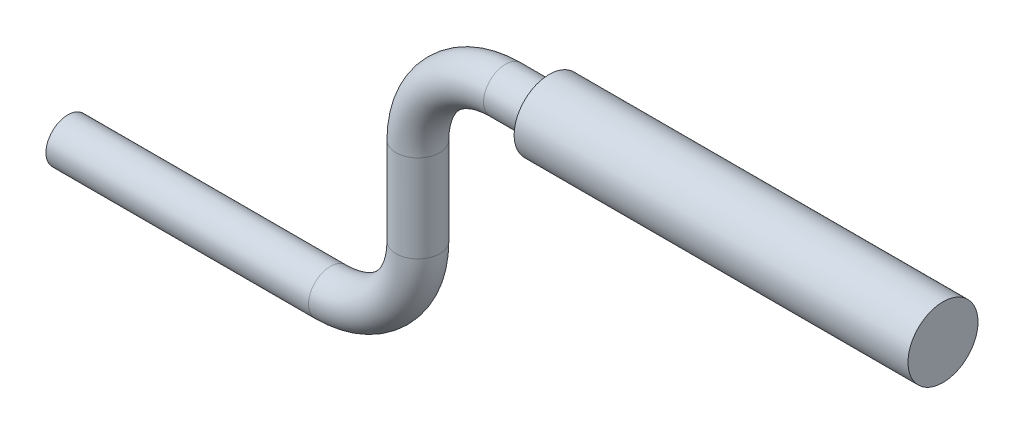
from build123d import *

# Parameters (mm, degrees)
ESQUISSE2_R        = 2.5
ESQUISSE3_R        = 4
BOSS_EXTRU_1_DEPTH = 45


with BuildPart() as part:
    # Balayage1: sweep along a path in Esquisse1
    with BuildLine(Plane.XY) as balayage1_path:
        Line((0, 0), (30, 0))
        ThreePointArc((30, 0), (37.071067812, 2.928932188), (40, 10))
        Line((40, 10), (40, 20))
        ThreePointArc((40, 20), (42.928932188, 27.071067812), (50, 30))
        Line((50, 30), (100, 30))
    # Esquisse2 → Balayage1 (sweep)
    with BuildSketch(Plane(origin=(100, 0, 0), x_dir=(0, 0, -1), z_dir=(1, 0, 0))):
        with Locations((0, 30)):
            Circle(ESQUISSE2_R)
    sweep(path=balayage1_path.line)

    # Esquisse3 → Boss.-Extru.1 (add)
    with BuildSketch(Plane(origin=(100, 0, 0), x_dir=(0, 0, -1), z_dir=(1, 0, 0))):
        with Locations((0, 30)):
            Circle(ESQUISSE3_R)
    extrude(amount=-BOSS_EXTRU_1_DEPTH)


solid = part.part
